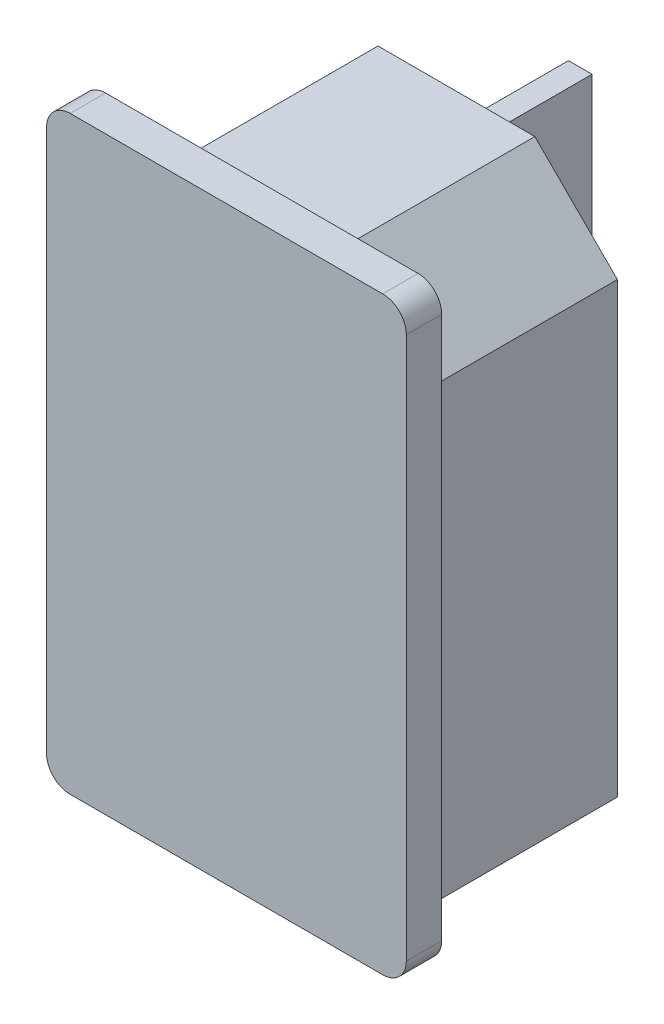
from build123d import *

# Parameters (mm, degrees)
BOSS_EXTRUDE1_DEPTH = 3
BOSS_EXTRUDE2_DEPTH = 16.5
CHAMFER1_SIZE       = 2
SKETCH4_W           = 2
SKETCH4_H           = 40
BOSS_EXTRUDE3_DEPTH = 10.5


with BuildPart() as part:
    # Sketch1 → Boss-Extrude1 (new body)
    with BuildSketch(Plane.XY):
        with BuildLine():
            Line((-13.25, 25), (13.25, 25))
            ThreePointArc((13.25, 25), (14.664213562, 24.414213562), (15.25, 23))
            Line((15.25, 23), (15.25, -23))
            ThreePointArc((15.25, -23), (14.664213562, -24.414213562), (13.25, -25))
            Line((13.25, -25), (-13.25, -25))
            ThreePointArc((-13.25, -25), (-14.664213562, -24.414213562), (-15.25, -23))
            Line((-15.25, -23), (-15.25, 23))
            ThreePointArc((-15.25, 23), (-14.664213562, 24.414213562), (-13.25, 25))
        make_face()
    extrude(amount=-BOSS_EXTRUDE1_DEPTH)

    # Sketch2 → Boss-Extrude2 (add)
    with BuildSketch(Plane(origin=(0, 0, -3), x_dir=(-1, 0, 0), z_dir=(0, 0, -1))):
        Polygon((-13.65, 16.5), (-6.65, 23.5), (6.65, 23.5), (13.65, 16.5), (13.65, -23.5), (-13.65, -23.5), align=None)
    extrude(amount=BOSS_EXTRUDE2_DEPTH)

    # Chamfer1
    chamfer1_edges = [part.edges().sort_by_distance(p)[0] for p in [
        (-13.65, -23.5, -11.25),
        (13.65, -23.5, -11.25),
    ]]
    chamfer(chamfer1_edges, length=CHAMFER1_SIZE)

    # Sketch4 → Boss-Extrude3 (add)
    with BuildSketch(Plane(origin=(0, 0, -19.5), x_dir=(-1, 0, 0), z_dir=(0, 0, -1))):
        Rectangle(SKETCH4_W, SKETCH4_H)
    extrude(amount=BOSS_EXTRUDE3_DEPTH)


solid = part.part
